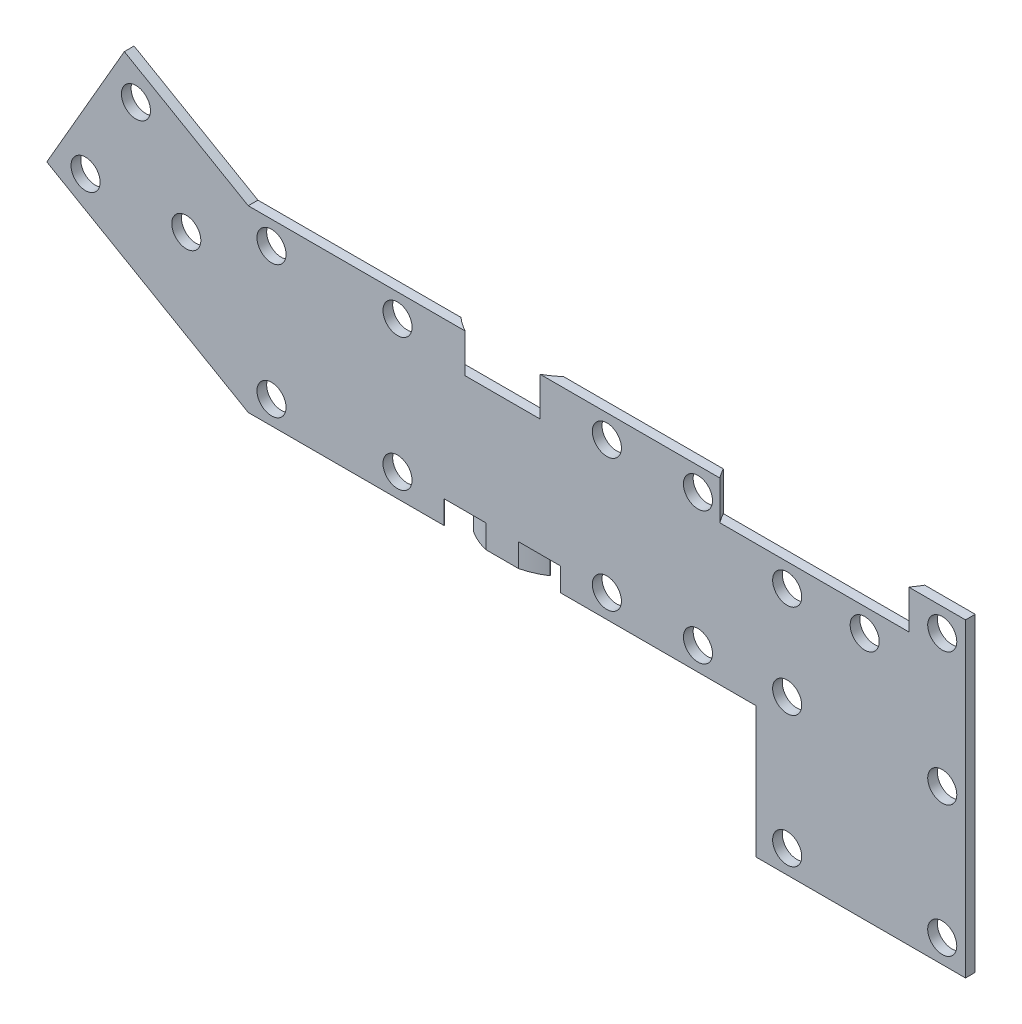
from build123d import *

# Parameters (mm, degrees)
SKETCH1_R           = 4.7625
BOSS_EXTRUDE1_DEPTH = 3.175
SKETCH2_R           = 29.21
SKETCH2_R_2         = 22.86
CUT_EXTRUDE1_DEPTH  = 7.62
SKETCH5_R           = 38.1
SKETCH5_R_2         = 25.4
CUT_EXTRUDE5_DEPTH  = 12.7


with BuildPart() as part:
    # Sketch1 → Boss-Extrude1 (new body)
    with BuildSketch(Plane.XY):
        Polygon((0, 0), (-40.591135768, 23.435303163), (-65.991135768, -20.55878735), (0, -58.65878735), (64.135, -58.65878735), (64.135, -51.03878735), (70.612, -51.03878735), (70.612, -58.65878735), (95.758, -58.65878735), (95.758, -51.03878735), (102.235, -51.03878735), (102.235, -58.65878735), (166.37, -58.65878735), (166.37, -101.6), (234.95, -101.6), (234.95, 0), align=None)
        with Locations((-20.295567884, -17.611742094)):
            Circle(SKETCH1_R, mode=Mode.SUBTRACT)
        with Locations((-53.291135768, -17.611742094)):
            Circle(SKETCH1_R, mode=Mode.SUBTRACT)
        with Locations((-36.793351826, 10.963257906)):
            Circle(SKETCH1_R, mode=Mode.SUBTRACT)
        with Locations((7.62, -51.03878735)):
            Circle(SKETCH1_R, mode=Mode.SUBTRACT)
        with Locations((7.62, -7.62)):
            Circle(SKETCH1_R, mode=Mode.SUBTRACT)
        with Locations((48.895, -7.62)):
            Circle(SKETCH1_R, mode=Mode.SUBTRACT)
        with Locations((117.475, -7.62)):
            Circle(SKETCH1_R, mode=Mode.SUBTRACT)
        with Locations((147.32, -7.62)):
            Circle(SKETCH1_R, mode=Mode.SUBTRACT)
        with Locations((117.475, -51.03878735)):
            Circle(SKETCH1_R, mode=Mode.SUBTRACT)
        with Locations((48.895, -51.03878735)):
            Circle(SKETCH1_R, mode=Mode.SUBTRACT)
        with Locations((147.32, -51.03878735)):
            Circle(SKETCH1_R, mode=Mode.SUBTRACT)
        with Locations((176.53, -20.32)):
            Circle(SKETCH1_R, mode=Mode.SUBTRACT)
        with Locations((201.93, -20.32)):
            Circle(SKETCH1_R, mode=Mode.SUBTRACT)
        with Locations((227.33, -7.62)):
            Circle(SKETCH1_R, mode=Mode.SUBTRACT)
        with Locations((227.33, -93.98)):
            Circle(SKETCH1_R, mode=Mode.SUBTRACT)
        with Locations((176.53, -93.98)):
            Circle(SKETCH1_R, mode=Mode.SUBTRACT)
        with Locations((227.33, -51.03878735)):
            Circle(SKETCH1_R, mode=Mode.SUBTRACT)
        with Locations((176.53, -51.03878735)):
            Circle(SKETCH1_R, mode=Mode.SUBTRACT)
    extrude(amount=BOSS_EXTRUDE1_DEPTH)

    # Sketch2 → Cut-Extrude1 (cut)
    with BuildSketch(Plane.XZ.offset(58.65878735)):
        with Locations((83.185, -19.05)):
            Circle(SKETCH2_R)
        with Locations((83.185, -19.05)):
            Circle(SKETCH2_R_2, mode=Mode.SUBTRACT)
    extrude(amount=-CUT_EXTRUDE1_DEPTH, mode=Mode.SUBTRACT)

    # Sketch5 → Cut-Extrude5 (cut)
    with BuildSketch(Plane(origin=(0, 0, 0), x_dir=(1, 0, 0), z_dir=(0, 1, 0))):
        with Locations((185.42, 19.05)):
            Circle(SKETCH5_R)
        with Locations((83.312, 19.05)):
            Circle(SKETCH5_R_2)
    extrude(amount=-CUT_EXTRUDE5_DEPTH, mode=Mode.SUBTRACT)


solid = part.part
